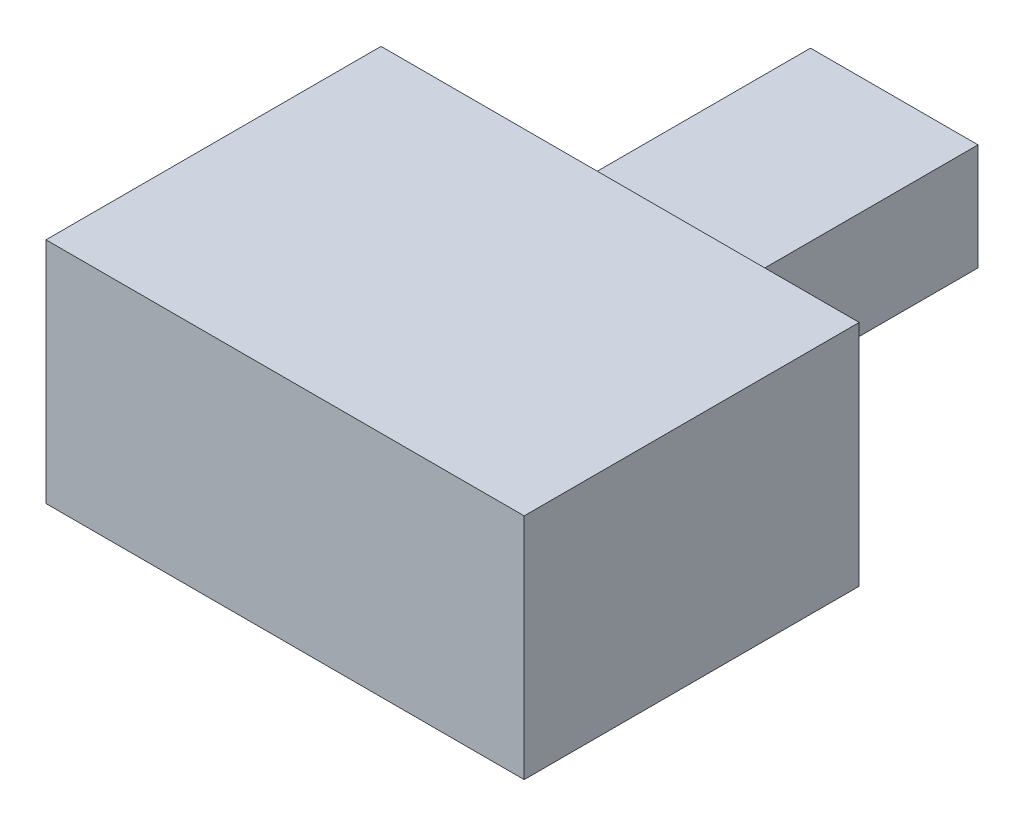
from build123d import *

# Parameters (mm, degrees)
SKETCH1_W           = 15.7
SKETCH1_H           = 7.5
BOSS_EXTRUDE1_DEPTH = 11
SKETCH2_W           = 5.5
SKETCH2_H           = 3.5
BOSS_EXTRUDE2_DEPTH = 9


with BuildPart() as part:
    # Sketch1 → Boss-Extrude1 (new body)
    with BuildSketch(Plane.XY):
        Rectangle(SKETCH1_W, SKETCH1_H)
    extrude(amount=BOSS_EXTRUDE1_DEPTH)

    # Sketch2 → Boss-Extrude2 (add)
    with BuildSketch(Plane(origin=(0, 0, 0), x_dir=(-1, 0, 0), z_dir=(0, 0, -1))):
        Rectangle(SKETCH2_W, SKETCH2_H)
    extrude(amount=BOSS_EXTRUDE2_DEPTH)


solid = part.part
